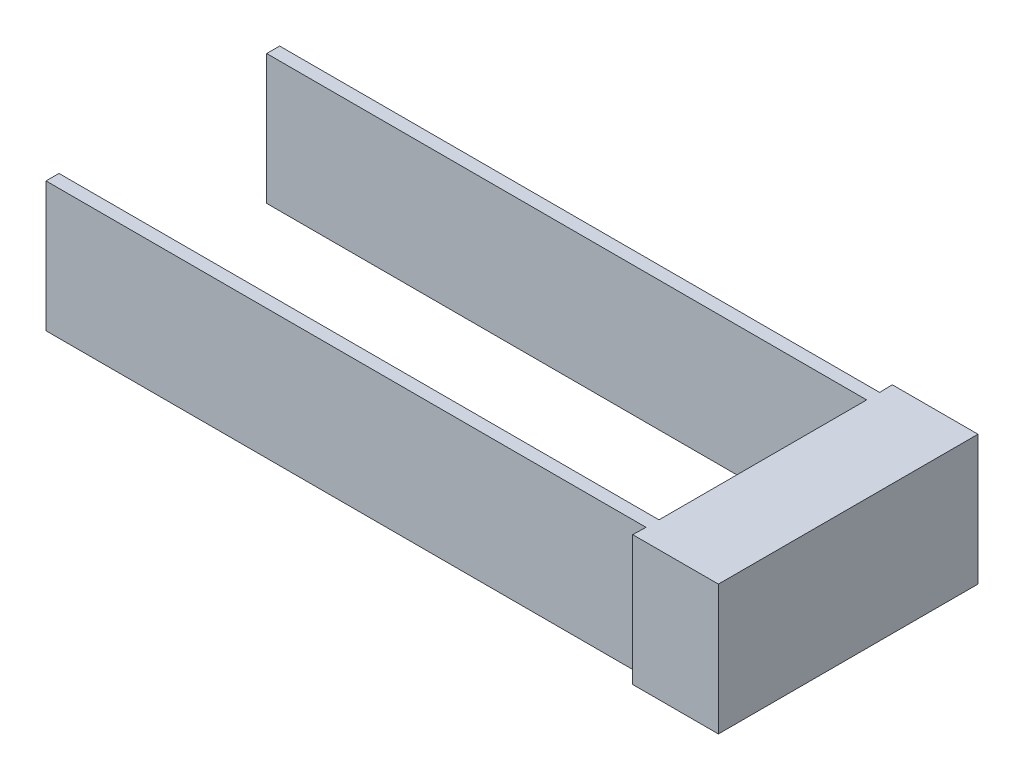
from build123d import *

# Parameters (mm, degrees)
BOSS_EXTRUDE1_DEPTH = 25


with BuildPart() as part:
    # Sketch1 → Boss-Extrude1 (new body)
    with BuildSketch(Plane(origin=(0, 0, 0), x_dir=(1, 0, 0), z_dir=(0, 1, 0))):
        Polygon((49.558380479, 0), (49.5, -2.5), (66, -2.5), (66, 0), (66, 45), (66, 47.5), (49.5, 47.5), (49.558380479, 45), (-66, 45), (-66, 42.5), (49.558380479, 42.5), (49.558380479, 2.5), (-66, 2.5), (-66, 0), align=None)
    extrude(amount=BOSS_EXTRUDE1_DEPTH)


solid = part.part
